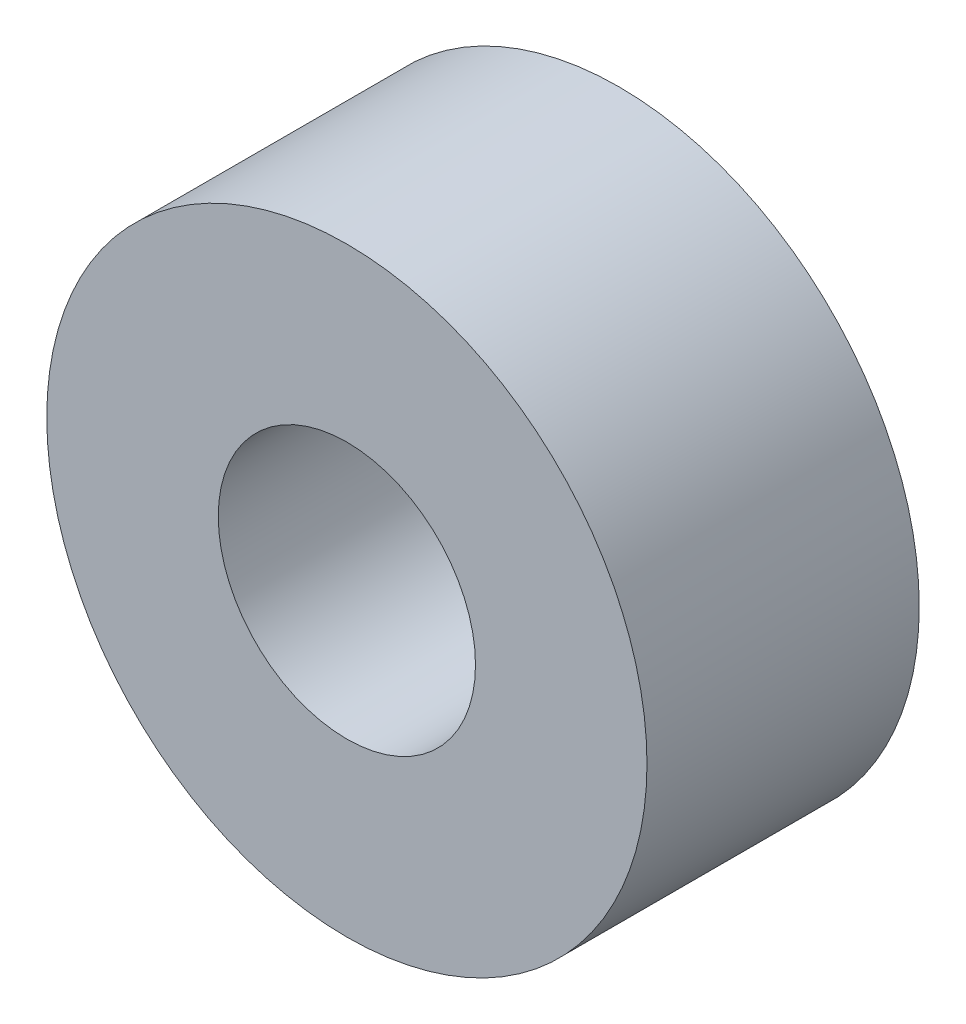
from build123d import *

# Parameters (mm, degrees)
SKETCH1_R           = 3.5
SKETCH1_R_2         = 1.5
BOSS_EXTRUDE1_DEPTH = 3.175


with BuildPart() as part:
    # Sketch1 → Boss-Extrude1 (new body)
    with BuildSketch(Plane.XY):
        Circle(SKETCH1_R)
        Circle(SKETCH1_R_2, mode=Mode.SUBTRACT)
    extrude(amount=BOSS_EXTRUDE1_DEPTH)


solid = part.part
